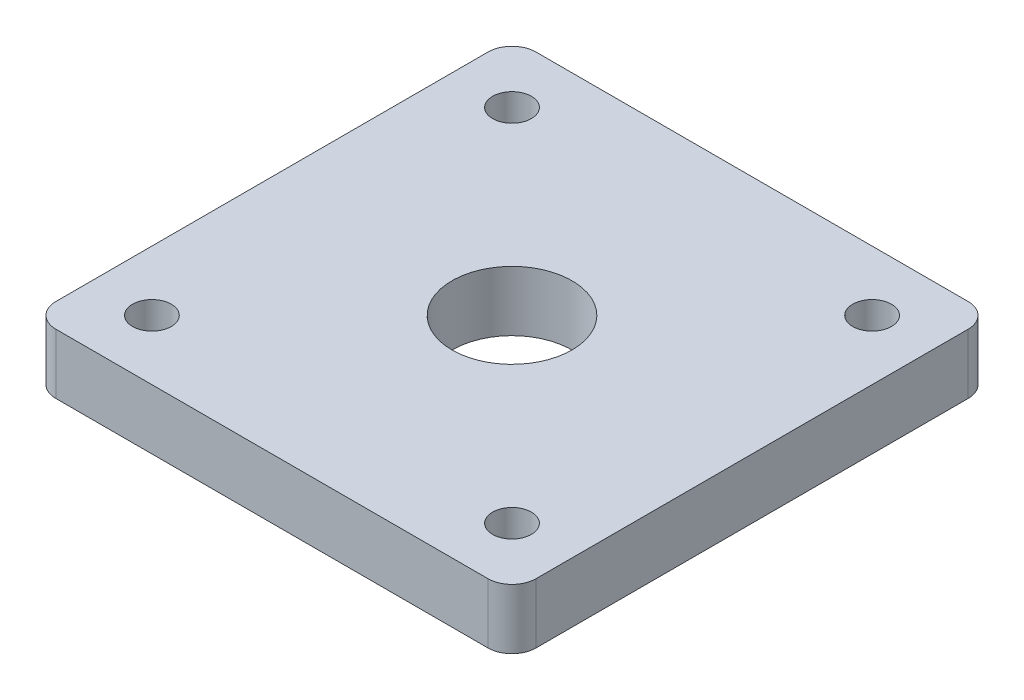
from build123d import *

# Parameters (mm, degrees)
SKETCH2_R           = 2.05
SKETCH2_R_2         = 6.35
BOSS_EXTRUDE1_DEPTH = 6.35


with BuildPart() as part:
    # Sketch2 → Boss-Extrude1 (new body)
    with BuildSketch(Plane(origin=(0, 0, 0), x_dir=(1, 0, 0), z_dir=(0, 1, 0))):
        with BuildLine():
            ThreePointArc((-25.4, 22.86), (-24.656051224, 24.656051224), (-22.86, 25.4))
            Line((-22.86, 25.4), (22.86, 25.4))
            ThreePointArc((22.86, 25.4), (24.656051224, 24.656051224), (25.4, 22.86))
            Line((25.4, 22.86), (25.4, -22.86))
            ThreePointArc((25.4, -22.86), (24.656051224, -24.656051224), (22.86, -25.4))
            Line((22.86, -25.4), (-22.86, -25.4))
            ThreePointArc((-22.86, -25.4), (-24.656051224, -24.656051224), (-25.4, -22.86))
            Line((-25.4, -22.86), (-25.4, 22.86))
        make_face()
        with Locations(Location((-19.05, -19.05, 0), (0, 0, 270))):
            Circle(SKETCH2_R, mode=Mode.SUBTRACT)
        with Locations(Location((19.05, -19.05, 0), (0, 0, 270))):
            Circle(SKETCH2_R, mode=Mode.SUBTRACT)
        with Locations(Location((19.05, 19.05, 0), (0, 0, 270))):
            Circle(SKETCH2_R, mode=Mode.SUBTRACT)
        with Locations(Location((0, 0, 0), (0, 0, 270))):
            Circle(SKETCH2_R_2, mode=Mode.SUBTRACT)
        with Locations(Location((-19.05, 19.05, 0), (0, 0, 270))):
            Circle(SKETCH2_R, mode=Mode.SUBTRACT)
    extrude(amount=BOSS_EXTRUDE1_DEPTH)


solid = part.part
